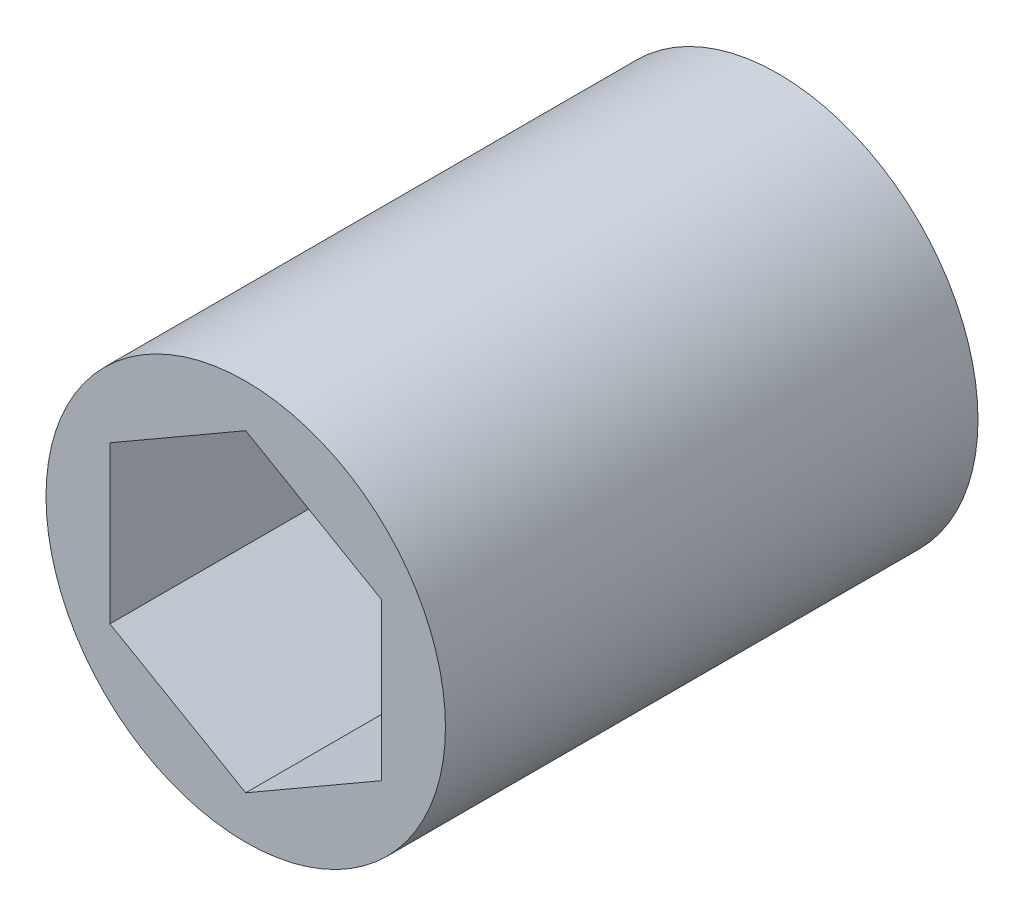
from build123d import *

# Parameters (mm, degrees)
SKETCH1_R           = 9.525
BOSS_EXTRUDE1_DEPTH = 12.7


with BuildPart() as part:
    # Sketch1 → Boss-Extrude1 (new, symmetric)
    with BuildSketch(Plane.XY):
        Circle(SKETCH1_R)
        Polygon((0, 7.478995387), (-6.477, 3.739497694), (-6.477, -3.739497694), (0, -7.478995387), (6.477, -3.739497694), (6.477, 3.739497694), align=None, mode=Mode.SUBTRACT)
    extrude(amount=BOSS_EXTRUDE1_DEPTH, both=True)


solid = part.part
